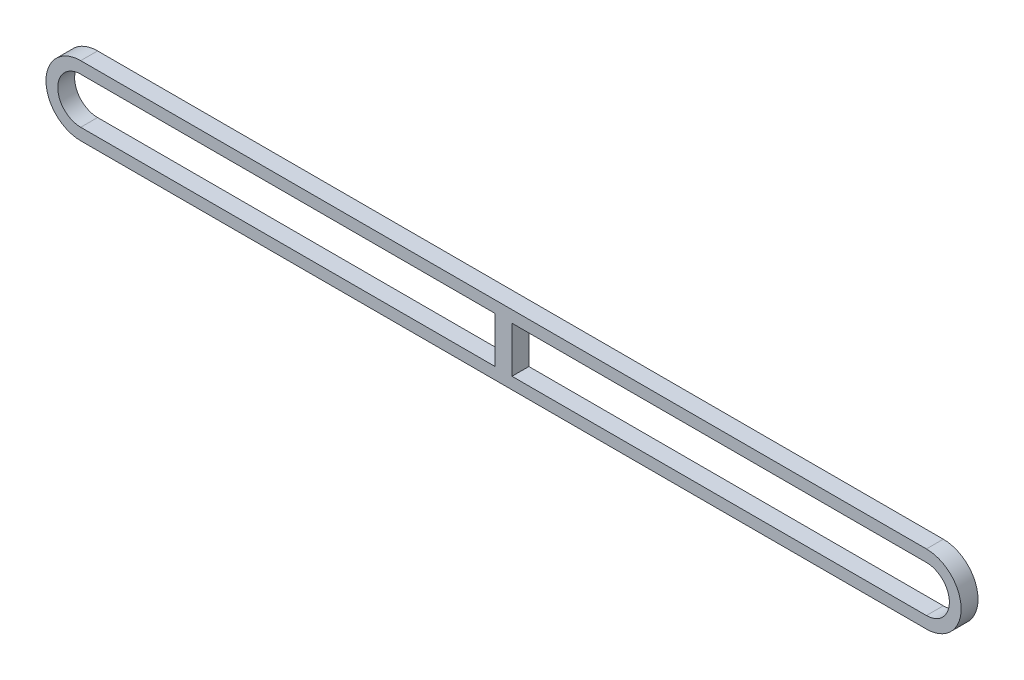
from build123d import *

# Parameters (mm, degrees)
BOSS_EXTRUDE1_DEPTH             = 2.3876
BOSS_EXTRUDE2_REACH             = 126.668
SKETCH2_W                       = 2.3876
SKETCH2_H                       = 2.3876
BOSS_EXTRUDE2_DIRECTION_2_REACH = 126.668


with BuildPart() as part:
    # Sketch1 → Boss-Extrude1 (new body)
    with BuildSketch(Plane.XY):
        with BuildLine():
            Line((0, 4.91087), (119.637, 4.91087))
            ThreePointArc((119.637, 4.91087), (124.54787, 0), (119.637, -4.91087))
            Line((119.637, -4.91087), (0, -4.91087))
            ThreePointArc((0, -4.91087), (-4.91087, 0), (0, 4.91087))
        make_face()
        with BuildLine():
            Line((0, 3.25), (119.637, 3.25))
            ThreePointArc((119.637, 3.25), (122.887, 0), (119.637, -3.25))
            Line((119.637, -3.25), (0, -3.25))
            ThreePointArc((0, -3.25), (-3.25, 0), (0, 3.25))
        make_face(mode=Mode.SUBTRACT)
    extrude(amount=-BOSS_EXTRUDE1_DEPTH)

    # Sketch2 → Boss-Extrude2 (add, up to next)
    with BuildSketch(Plane(origin=(0, 0, 0), x_dir=(1, 0, 0), z_dir=(0, 1, 0)), mode=Mode.PRIVATE) as boss_extrude2_sk1:
        with Locations((59.8185, 1.1938)):
            Rectangle(SKETCH2_W, SKETCH2_H)
    boss_extrude2_tool1 = extrude(boss_extrude2_sk1.sketch, amount=BOSS_EXTRUDE2_REACH, mode=Mode.PRIVATE) - part.part
    add(boss_extrude2_tool1.solids().sort_by_distance((59.8185, 0, -1.1938))[0])

    # Sketch2 → Boss-Extrude2 direction 2 (add, up to next)
    with BuildSketch(Plane(origin=(0, 0, 0), x_dir=(1, 0, 0), z_dir=(0, 1, 0)), mode=Mode.PRIVATE) as boss_extrude2_direction_2_sk1:
        with Locations((59.8185, 1.1938)):
            Rectangle(SKETCH2_W, SKETCH2_H)
    boss_extrude2_direction_2_tool1 = extrude(boss_extrude2_direction_2_sk1.sketch, amount=-BOSS_EXTRUDE2_DIRECTION_2_REACH, mode=Mode.PRIVATE) - part.part
    add(boss_extrude2_direction_2_tool1.solids().sort_by_distance((59.8185, 0, -1.1938))[0])


solid = part.part
